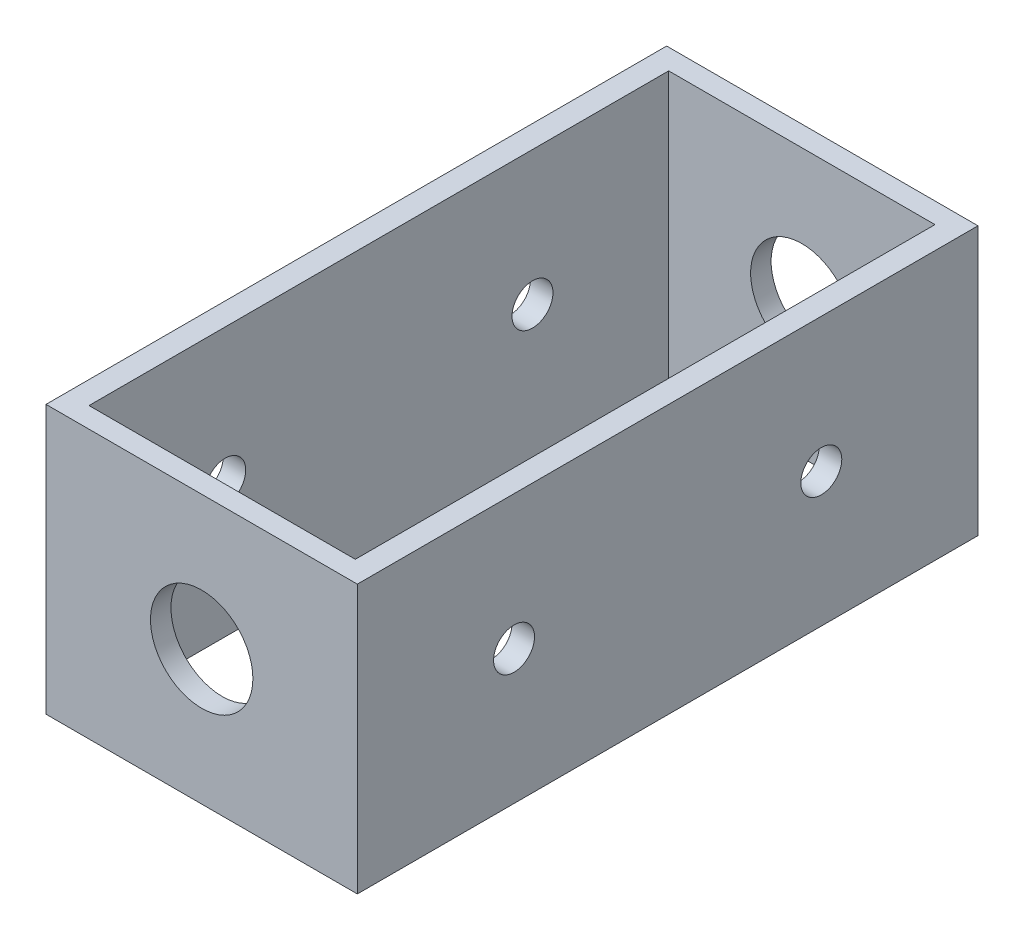
from build123d import *

# Parameters (mm, degrees)
SKETCH1_W           = 15.2
SKETCH1_H           = 30.3
SKETCH1_W_2         = 13
SKETCH1_H_2         = 28.3
BOSS_EXTRUDE1_DEPTH = 13.1
SKETCH2_R           = 1
CUT_EXTRUDE1_DEPTH  = 26.143040787
SKETCH3_R           = 2.5
CUT_EXTRUDE2_DEPTH  = 34.874178957


with BuildPart() as part:
    # Sketch1 → Boss-Extrude1 (new body)
    with BuildSketch(Plane(origin=(0, 0, 0), x_dir=(1, 0, 0), z_dir=(0, 1, 0))):
        Rectangle(SKETCH1_W, SKETCH1_H)
        Rectangle(SKETCH1_W_2, SKETCH1_H_2, mode=Mode.SUBTRACT)
    extrude(amount=BOSS_EXTRUDE1_DEPTH)

    # Sketch2 → Cut-Extrude1 (cut, through all)
    with BuildSketch(Plane(origin=(7.6, 0, 0), x_dir=(0, 0, -1), z_dir=(1, 0, 0))):
        with Locations((-7.5, 6.55)):
            Circle(SKETCH2_R)
        with Locations((7.5, 6.55)):
            Circle(SKETCH2_R)
    extrude(amount=-CUT_EXTRUDE1_DEPTH, mode=Mode.SUBTRACT)

    # Sketch3 → Cut-Extrude2 (cut, through all)
    with BuildSketch(Plane.XY.offset(15.15)):
        with Locations((0, 6.55)):
            Circle(SKETCH3_R)
    extrude(amount=-CUT_EXTRUDE2_DEPTH, mode=Mode.SUBTRACT)


solid = part.part
